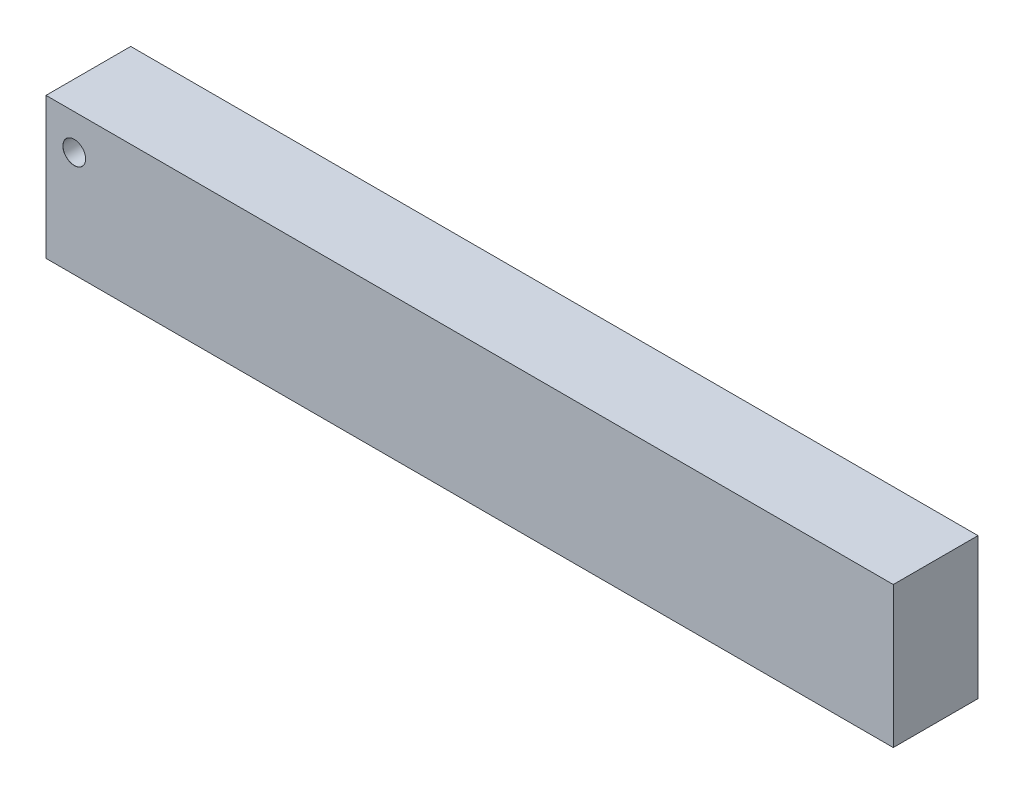
from build123d import *

# Parameters (mm, degrees)
SKETCH1_W                       = 300
SKETCH1_H                       = 50
BOSS_EXTRUDE1_DEPTH             = 30
F_8_0MM_DOWEL_HOLE1_D           = 8
F_8_0MM_DOWEL_HOLE1_CSINK_D     = 8.05
F_8_0MM_DOWEL_HOLE1_CSINK_ANGLE = 90


with BuildPart() as part:
    # Sketch1 → Boss-Extrude1 (new body)
    with BuildSketch(Plane.XY):
        with Locations((150, 25)):
            Rectangle(SKETCH1_W, SKETCH1_H)
    extrude(amount=BOSS_EXTRUDE1_DEPTH)

    # Ø8.0mm Dowel Hole1 (through all)
    with Locations(Plane.XY.offset(30)):
        with Locations((10, 37.5)):
            CounterSinkHole(F_8_0MM_DOWEL_HOLE1_D / 2, F_8_0MM_DOWEL_HOLE1_CSINK_D / 2, counter_sink_angle=F_8_0MM_DOWEL_HOLE1_CSINK_ANGLE)


solid = part.part
